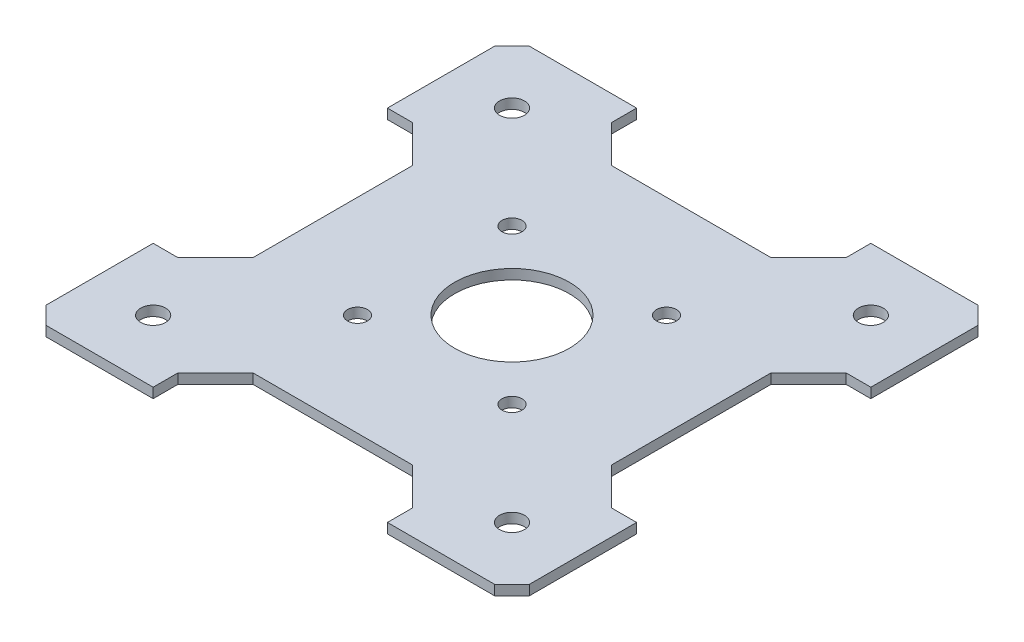
from build123d import *

# Parameters (mm, degrees)
SKETCH1_W           = 72
SKETCH1_H           = 72
BOSS_EXTRUDE1_DEPTH = 2
SKETCH5_W           = 25
SKETCH5_H           = 25
BOSS_EXTRUDE2_DEPTH = 2
SKETCH3_R           = 2
SKETCH3_R_2         = 11.5
SKETCH3_R_3         = 2.5
CUT_EXTRUDE1_DEPTH  = 69.618510622
CHAMFER1_SIZE       = 7.5
CHAMFER2_SIZE       = 3.5


with BuildPart() as part:
    # Sketch1 → Boss-Extrude1 (new body)
    with BuildSketch(Plane(origin=(0, 0, 0), x_dir=(1, 0, 0), z_dir=(0, 1, 0))):
        Rectangle(SKETCH1_W, SKETCH1_H)
    extrude(amount=BOSS_EXTRUDE1_DEPTH)

    # Sketch5 → Boss-Extrude2 (add)
    with BuildSketch(Plane(origin=(0, 2, 0), x_dir=(1, 0, 0), z_dir=(0, 1, 0))):
        with Locations((-36, -36)):
            Rectangle(SKETCH5_W, SKETCH5_H)
        with Locations((36, -36)):
            Rectangle(SKETCH5_W, SKETCH5_H)
        with Locations((36, 36)):
            Rectangle(SKETCH5_W, SKETCH5_H)
        with Locations((-36, 36)):
            Rectangle(SKETCH5_W, SKETCH5_H)
    extrude(amount=-BOSS_EXTRUDE2_DEPTH)

    # Sketch3 → Cut-Extrude1 (cut, through all)
    with BuildSketch(Plane(origin=(0, 2, 0), x_dir=(1, 0, 0), z_dir=(0, 1, 0))):
        with Locations(Location((-15.5, 15.5, 0), (0, 0, 270))):
            Circle(SKETCH3_R)
        with Locations(Location((15.5, 15.5, 0), (0, 0, 270))):
            Circle(SKETCH3_R)
        with Locations(Location((15.5, -15.5, 0), (0, 0, 270))):
            Circle(SKETCH3_R)
        with Locations(Location((-15.5, -15.5, 0), (0, 0, 270))):
            Circle(SKETCH3_R)
        with Locations(Location((0, 0, 0), (0, 0, 270))):
            Circle(SKETCH3_R_2)
        with Locations(Location((-36, -36, 0), (0, 0, 270))):
            Circle(SKETCH3_R_3)
        with Locations(Location((36, -36, 0), (0, 0, 90))):
            Circle(SKETCH3_R_3)
        with Locations(Location((36, 36, 0), (0, 0, 270))):
            Circle(SKETCH3_R_3)
        with Locations(Location((-36, 36, 0), (0, 0, 90))):
            Circle(SKETCH3_R_3)
    extrude(amount=-CUT_EXTRUDE1_DEPTH, mode=Mode.SUBTRACT)

    # Chamfer1
    chamfer1_edges = [part.edges().sort_by_distance(p)[0] for p in [
        (-23.5, 1, 36),
        (-36, 1, 23.5),
        (36, 1, 23.5),
        (23.5, 1, 36),
        (36, 1, -23.5),
        (23.5, 1, -36),
        (-36, 1, -23.5),
        (-23.5, 1, -36),
    ]]
    chamfer(chamfer1_edges, length=CHAMFER1_SIZE)

    # Chamfer2
    chamfer2_edges = [part.edges().sort_by_distance(p)[0] for p in [
        (-48.5, 1, 48.5),
        (48.5, 1, 48.5),
        (48.5, 1, -48.5),
        (-48.5, 1, -48.5),
    ]]
    chamfer(chamfer2_edges, length=CHAMFER2_SIZE)


solid = part.part
